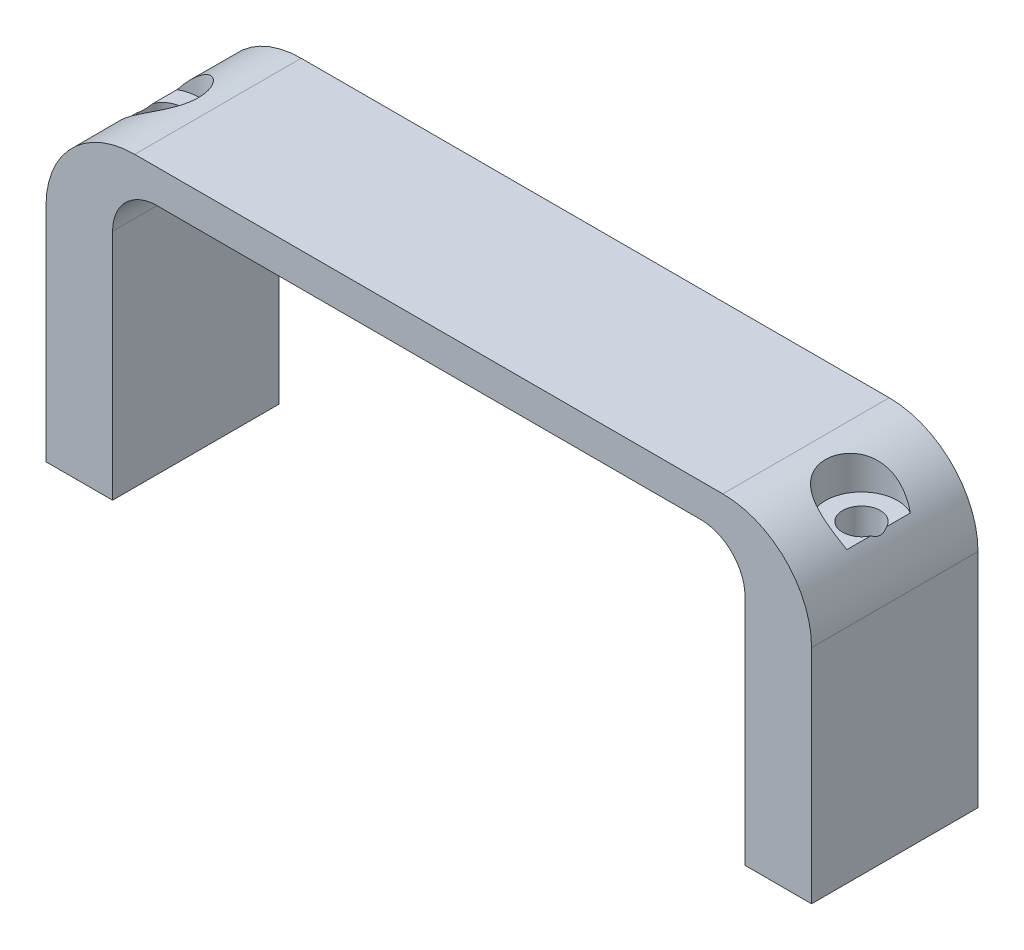
from build123d import *

# Parameters (mm, degrees)
P_IDAT_VYSUNUT_M1_DEPTH                          = 15
V_LCOV_ZAHLOUBEN_PRO_M3_ROUBY_S_VNIT_D           = 3.4
V_LCOV_ZAHLOUBEN_PRO_M3_ROUBY_S_VNIT_CBORE_D     = 6.5
V_LCOV_ZAHLOUBEN_PRO_M3_ROUBY_S_VNIT_CBORE_DEPTH = 3.4


with BuildPart() as part:
    # Skica1 → Přidat vysunutím1 (new body)
    with BuildSketch(Plane.XY):
        with BuildLine():
            Line((-23.771796173, 0), (29.228203827, 0))
            ThreePointArc((29.228203827, 0), (34.885058077, -2.343145751), (37.228203827, -8))
            Line((37.228203827, -8), (37.228203827, -28))
            Line((37.228203827, -28), (31.228203827, -28))
            Line((31.228203827, -28), (31.228203827, -7))
            ThreePointArc((31.228203827, -7), (30.056630952, -4.171572875), (27.228203827, -3))
            Line((27.228203827, -3), (-21.771796173, -3))
            ThreePointArc((-21.771796173, -3), (-24.600223298, -4.171572875), (-25.771796173, -7))
            Line((-25.771796173, -7), (-25.771796173, -28))
            Line((-25.771796173, -28), (-31.771796173, -28))
            Line((-31.771796173, -28), (-31.771796173, -8))
            ThreePointArc((-31.771796173, -8), (-29.428650422, -2.343145751), (-23.771796173, 0))
        make_face()
    extrude(amount=P_IDAT_VYSUNUT_M1_DEPTH)

    # Válcové zahloubení pro M3 šrouby s vnitřním šestihranem1 (through all)
    with Locations(Plane(origin=(0, 0, 0), x_dir=(1, 0, 0), z_dir=(0, 1, 0))):
        with Locations((-28.771796173, -7.5), (34.228203827, -7.5)):
            CounterBoreHole(V_LCOV_ZAHLOUBEN_PRO_M3_ROUBY_S_VNIT_D / 2, V_LCOV_ZAHLOUBEN_PRO_M3_ROUBY_S_VNIT_CBORE_D / 2, V_LCOV_ZAHLOUBEN_PRO_M3_ROUBY_S_VNIT_CBORE_DEPTH)


solid = part.part
